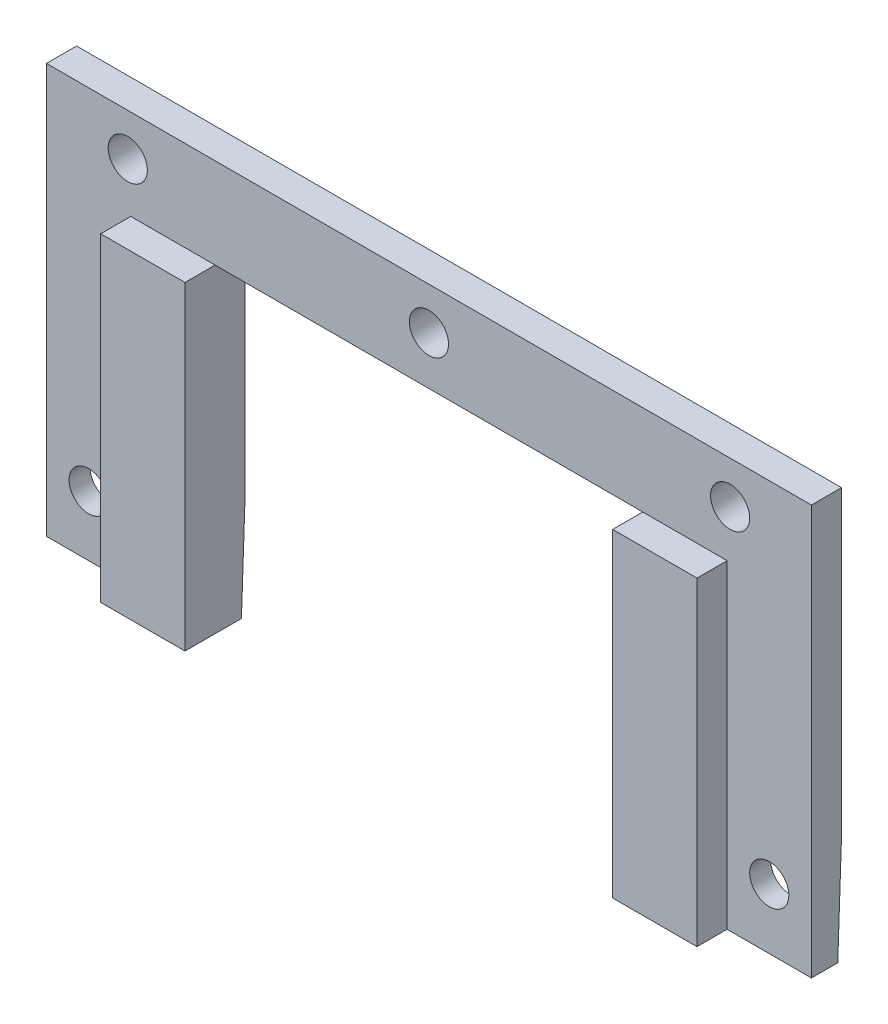
from build123d import *

# Parameters (mm, degrees)
SKETCH2_R            = 3.25
BOSS_EXTRUDE2_DEPTH  = 5
SKETCH4_W            = 14
SKETCH4_H            = 53
RIBS_DEPTH           = 5
ANGLE_CUT_DEPTH      = 132.746916472
ANGLE_CUT_DEPTH_BACK = 132.746916472
SKETCH3_R            = 6.5
COUNTERBORE_DEPTH    = 1.5
SKETCH6_R            = 3.25
BOLT_THRU_HOLE_DEPTH = 105.895123001


with BuildPart() as part:
    # Sketch2 → Boss-Extrude2 (new body)
    with BuildSketch(Plane.XY):
        Polygon((-63.5, 47), (-63.5, 115), (63.5, 115), (63.5, 47), (35.5, 47), (35.5, 100), (-35.5, 100), (-35.5, 47), align=None)
        with Locations((-50, 108)):
            Circle(SKETCH2_R, mode=Mode.SUBTRACT)
        with Locations((50, 108)):
            Circle(SKETCH2_R, mode=Mode.SUBTRACT)
        with Locations((0, 108)):
            Circle(SKETCH2_R, mode=Mode.SUBTRACT)
    extrude(amount=BOSS_EXTRUDE2_DEPTH)

    # Sketch4 → Ribs (add)
    with BuildSketch(Plane.XY.offset(5)):
        with Locations((-42.5, 73.5)):
            Rectangle(SKETCH4_W, SKETCH4_H)
        with Locations((42.5, 73.5)):
            Rectangle(SKETCH4_W, SKETCH4_H)
    extrude(amount=RIBS_DEPTH)

    # Sketch5 → Angle Cut (cut, two sides: drawn at the far end of the back side and taken through both)
    with BuildSketch(Plane(origin=(0, 0, 0), x_dir=(0, 0, -1), z_dir=(1, 0, 0)).offset(-ANGLE_CUT_DEPTH_BACK)):
        Polygon((0, 47), (0, 65), (-0.628573851, 47), align=None)
    extrude(amount=ANGLE_CUT_DEPTH + ANGLE_CUT_DEPTH_BACK, mode=Mode.SUBTRACT)

    # Sketch3 → Counterbore (cut)
    with BuildSketch(Plane(origin=(0, 93.494633495, 0), x_dir=(-1, 0, 0), z_dir=(0, 0, 1))):
        with Locations(Location((56.5, 36.494633495, 0), (0, 0, 270))):
            Circle(SKETCH3_R)
        with Locations(Location((-56.5, 36.494633495, 0), (0, 0, 270))):
            Circle(SKETCH3_R)
    extrude(amount=COUNTERBORE_DEPTH, mode=Mode.SUBTRACT)

    # Sketch6 → Bolt thru-hole (cut, through all)
    with BuildSketch(Plane(origin=(0, 129.889907886, 0), x_dir=(-1, 0, 0), z_dir=(0, 0, 1))):
        with Locations((-56.5, 72.889907886)):
            Circle(SKETCH6_R)
        with Locations((56.5, 72.889907886)):
            Circle(SKETCH6_R)
    extrude(amount=BOLT_THRU_HOLE_DEPTH, mode=Mode.SUBTRACT)


solid = part.part
